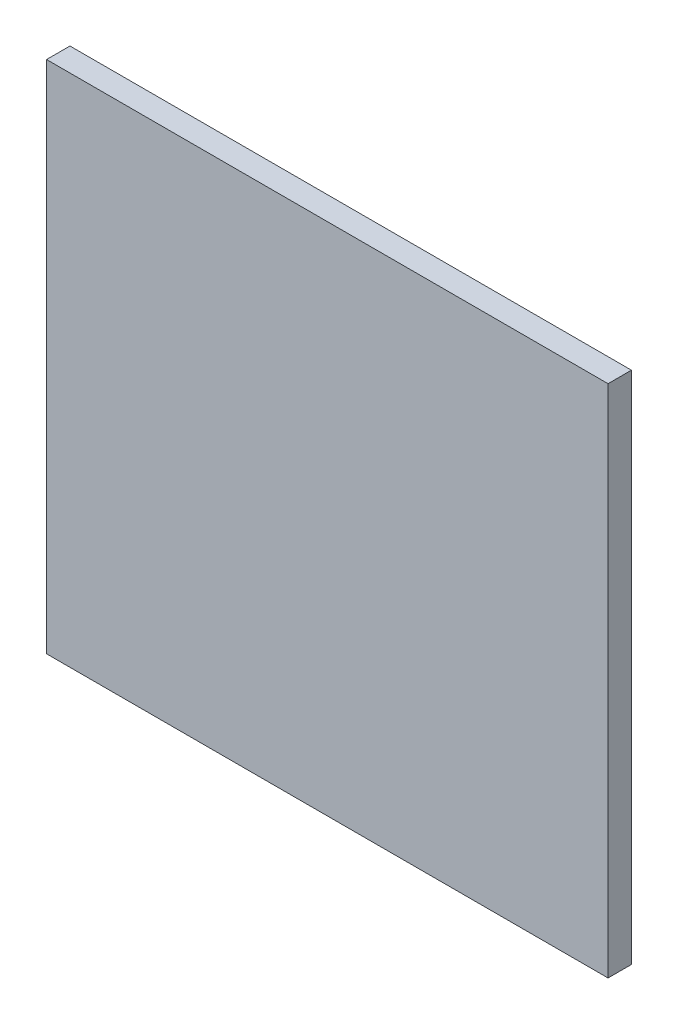
from build123d import *

# Parameters (mm, degrees)
SKETCH1_W           = 152.4
SKETCH1_H           = 139.7
BOSS_EXTRUDE1_DEPTH = 6.35


with BuildPart() as part:
    # Sketch1 → Boss-Extrude1 (new body)
    with BuildSketch(Plane.XY):
        Rectangle(SKETCH1_W, SKETCH1_H)
    extrude(amount=BOSS_EXTRUDE1_DEPTH)


solid = part.part
